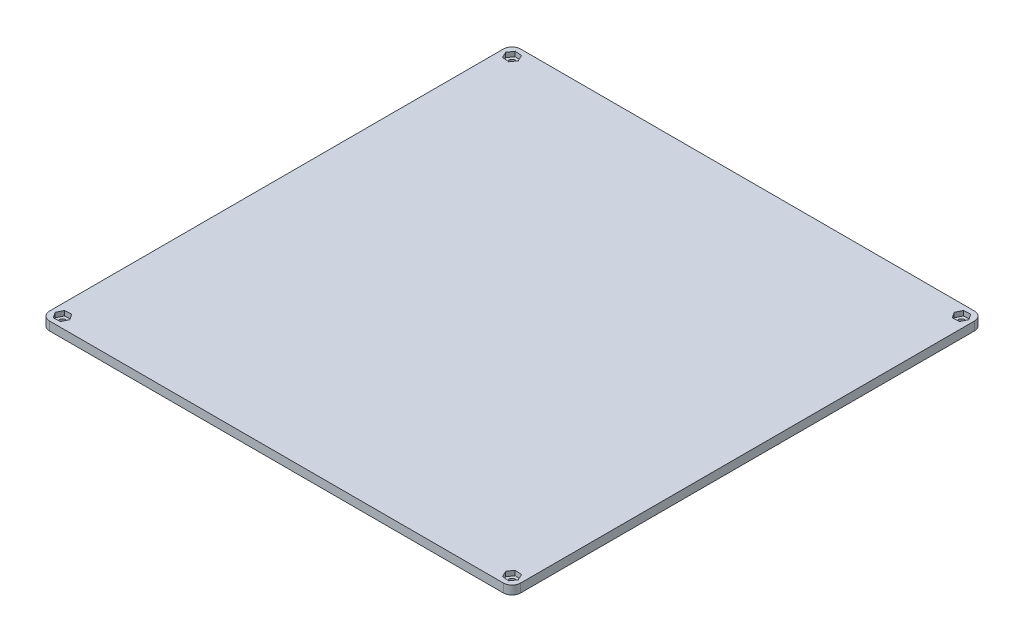
from build123d import *

# Parameters (mm, degrees)
SKETCH_1_W          = 218
SKETCH_1_H          = 218
EXTRUDE_1_DEPTH     = 4
FILLET_1_R          = 4
SKETCH_2_R          = 1.5
CUT_EXTRUDE_3_DEPTH = 2.2
SKETCH_2_3_R        = 1.5
CUT_EXTRUDE_4_DEPTH = 155.201167311


with BuildPart() as part:
    # 草图1 → 凸台-拉伸1 (new body)
    with BuildSketch(Plane(origin=(0, 0, 0), x_dir=(1, 0, 0), z_dir=(0, 1, 0))):
        Rectangle(SKETCH_1_W, SKETCH_1_H)
    extrude(amount=EXTRUDE_1_DEPTH)

    # 圆角1
    fillet_1_edges = [part.edges().sort_by_distance(p)[0] for p in [
        (-109, 2, -109),
        (109, 2, -109),
        (109, 2, 109),
        (-109, 2, 109),
    ]]
    fillet(fillet_1_edges, radius=FILLET_1_R)

    # 草图2 → 切除-拉伸3 (cut)
    # profile 1 of 4: a face of its own
    with BuildSketch(Plane(origin=(0, 4, 0), x_dir=(1, 0, 0), z_dir=(0, 1, 0))):
        Polygon((105.375169377, 106.862209377), (102.208838657, 106.622036303), (100.83366928, 103.759826926), (102.624830623, 101.137790623), (105.791161343, 101.377963697), (107.16633072, 104.240173074), align=None)
        with Locations((104, 104)):
            Circle(SKETCH_2_R, mode=Mode.SUBTRACT)
    # profile 2 of 4: a face of its own
    with BuildSketch(Plane(origin=(0, 4, 0), x_dir=(1, 0, 0), z_dir=(0, 1, 0))):
        Polygon((107.16633072, -104.240173074), (105.375169377, -106.862209377), (102.208838657, -106.622036303), (100.83366928, -103.759826926), (102.624830623, -101.137790623), (105.791161343, -101.377963697), align=None)
        with Locations((104, -104)):
            Circle(SKETCH_2_R, mode=Mode.SUBTRACT)
    # profile 3 of 4: a face of its own
    with BuildSketch(Plane(origin=(0, 4, 0), x_dir=(1, 0, 0), z_dir=(0, 1, 0))):
        Polygon((-107.16633072, -104.240173074), (-105.375169377, -106.862209377), (-102.208838657, -106.622036303), (-100.83366928, -103.759826926), (-102.624830623, -101.137790623), (-105.791161343, -101.377963697), align=None)
        with Locations((-104, -104)):
            Circle(SKETCH_2_R, mode=Mode.SUBTRACT)
    # profile 4 of 4: a face of its own
    with BuildSketch(Plane(origin=(0, 4, 0), x_dir=(1, 0, 0), z_dir=(0, 1, 0))):
        Polygon((-105.791161343, 101.377963697), (-107.16633072, 104.240173074), (-105.375169377, 106.862209377), (-102.208838657, 106.622036303), (-100.83366928, 103.759826926), (-102.624830623, 101.137790623), align=None)
        with Locations((-104, 104)):
            Circle(SKETCH_2_R, mode=Mode.SUBTRACT)
    extrude(amount=-CUT_EXTRUDE_3_DEPTH, mode=Mode.SUBTRACT)

    # 草图2<3> → 切除-拉伸4 (cut, through all)
    with BuildSketch(Plane(origin=(0, 4, 0), x_dir=(1, 0, 0), z_dir=(0, 1, 0))):
        with Locations((104, 104)):
            Circle(SKETCH_2_3_R)
        with Locations((104, -104)):
            Circle(SKETCH_2_3_R)
        with Locations((-104, -104)):
            Circle(SKETCH_2_3_R)
        with Locations((-104, 104)):
            Circle(SKETCH_2_3_R)
    extrude(amount=-CUT_EXTRUDE_4_DEPTH, mode=Mode.SUBTRACT)


solid = part.part
